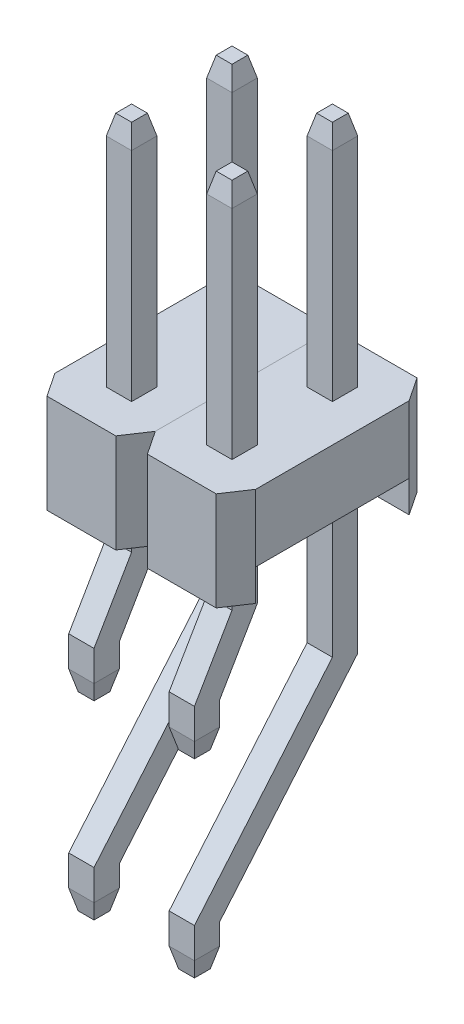
from build123d import *
from OCP.BRepFilletAPI import BRepFilletAPI_MakeChamfer

# Parameters (mm, degrees)
SKETCH_1_W             = 2.54
SKETCH_1_H             = 2.54
SKETCH_1_W_2           = 0.64
SKETCH_1_H_2           = 0.64
EXTRUDE_1_DEPTH        = 2.5
CHAMFER_1_SIZE         = 0.4
CHAMFER_1_SIZE2        = 0.6
CHAMFER_2_SIZE         = 0.6
CHAMFER_2_SIZE2        = 0.4
SKETCH_5_W             = 1.94
SKETCH_5_H             = 0.8
CUT_EXTRUDE_1_DEPTH    = 6
EXTRUDE_3_DEPTH        = 0.32
CHAMFER_3_SIZE         = 0.5
CHAMFER_3_SIZE2        = 0.12
CHAMFER_4_SIZE         = 0.5
CHAMFER_4_SIZE2        = 0.12
PATTERN_LINEAR_1_COUNT = 2
PATTERN_LINEAR_1_PITCH = 2.54


with BuildPart() as part:
    # 草图1 → 凸台-拉伸1 (new body)
    with BuildSketch(Plane(origin=(0, 0, 0), x_dir=(1, 0, 0), z_dir=(0, 1, 0))):
        with Locations((0, -1.27)):
            Rectangle(SKETCH_1_W, SKETCH_1_H)
        with Locations((0, -1.27)):
            Rectangle(SKETCH_1_W_2, SKETCH_1_H_2, mode=Mode.SUBTRACT)
    extrude(amount=EXTRUDE_1_DEPTH)

    # 倒角1
    chamfer_1_edges = [part.edges().sort_by_distance(p)[0] for p in [
        (1.27, 1.25, 2.54),
    ]]
    chamfer_1_side = [part.faces().sort_by_distance(p)[0] for p in [
        (0, 1.25, 2.54),
    ]]
    chamfer(chamfer_1_edges, length=CHAMFER_1_SIZE, length2=CHAMFER_1_SIZE2, reference=chamfer_1_side[0])

    # 倒角2
    chamfer_2_edges = [part.edges().sort_by_distance(p)[0] for p in [
        (-1.27, 1.25, 2.54),
    ]]
    chamfer_2_side = [part.faces().sort_by_distance(p)[0] for p in [
        (-1.27, 1.25, 1.27),
    ]]
    chamfer(chamfer_2_edges, length=CHAMFER_2_SIZE, length2=CHAMFER_2_SIZE2, reference=chamfer_2_side[0])

    # 草图5 → 切除-拉伸1 (cut)
    with BuildSketch(Plane(origin=(1.27, 0, 0), x_dir=(0, 0, -1), z_dir=(1, 0, 0))):
        with Locations((-0.97, 0.4)):
            Rectangle(SKETCH_5_W, SKETCH_5_H)
    extrude(amount=-CUT_EXTRUDE_1_DEPTH, mode=Mode.SUBTRACT)

    # 镜向1: part across plane


with BuildPart() as part_1:
    add(part.part)
    add(part.part.mirror(Plane(origin=(0, 2.5, 0), x_dir=(1, 0, 0), z_dir=(0, 0, -1))))

    # 草图6 → 凸台-拉伸3 (add, symmetric)
    with BuildSketch(Plane(origin=(0, 0, 0), x_dir=(0, 0, -1), z_dir=(1, 0, 0))):
        Polygon((-1.59, 8.5), (-0.95, 8.5), (-0.95, -0.972892443), (-1.9, -2.602892443), (-1.9, -3.7), (-2.54, -3.7), (-2.54, -2.43), (-1.59, -0.8), align=None)
        Polygon((0.95, 8.5), (1.59, 8.5), (1.59, -3.33420056), (-1.9, -7.46420056), (-1.9, -8.5), (-2.54, -8.5), (-2.54, -7.23), (0.95, -3.1), align=None)
    extrude(amount=EXTRUDE_3_DEPTH, both=True)

    # 倒角3: one chamfer whose edges measure the first distance from different faces: ONE call of the kernel's chamfer builder (chamfer() names one face for all edges)
    chamfer_3_edges_1 = [part_1.edges().sort_by_distance(p)[0] for p in [
        (-0.32, 8.5, 1.27),
    ]]
    chamfer_3_side_1 = [part_1.faces().sort_by_distance(p)[0] for p in [
        (-0.32, 5.5, 1.27),
    ]]
    chamfer_3_edges_2 = [part_1.edges().sort_by_distance(p)[0] for p in [
        (0, 8.5, 0.95),
    ]]
    chamfer_3_side_2 = [part_1.faces().sort_by_distance(p)[0] for p in [
        (0, 5.5, 0.95),
    ]]
    chamfer_3_edges_3 = [part_1.edges().sort_by_distance(p)[0] for p in [
        (0.32, 8.5, 1.27),
    ]]
    chamfer_3_side_3 = [part_1.faces().sort_by_distance(p)[0] for p in [
        (0.32, 5.5, 1.27),
    ]]
    chamfer_3_edges_4 = [part_1.edges().sort_by_distance(p)[0] for p in [
        (0, 8.5, -0.95),
    ]]
    chamfer_3_side_4 = [part_1.faces().sort_by_distance(p)[0] for p in [
        (0, 5.5, -0.95),
    ]]
    chamfer_3_edges_5 = [part_1.edges().sort_by_distance(p)[0] for p in [
        (-0.32, 8.5, -1.27),
    ]]
    chamfer_3_side_5 = [part_1.faces().sort_by_distance(p)[0] for p in [
        (-0.32, 5.5, -1.27),
    ]]
    chamfer_3_edges_6 = [part_1.edges().sort_by_distance(p)[0] for p in [
        (0, 8.5, -1.59),
    ]]
    chamfer_3_side_6 = [part_1.faces().sort_by_distance(p)[0] for p in [
        (0, 5.5, -1.59),
    ]]
    chamfer_3_edges_7 = [part_1.edges().sort_by_distance(p)[0] for p in [
        (0.32, 8.5, -1.27),
    ]]
    chamfer_3_side_7 = [part_1.faces().sort_by_distance(p)[0] for p in [
        (0.32, 5.5, -1.27),
    ]]
    chamfer_3_edges_8 = [part_1.edges().sort_by_distance(p)[0] for p in [
        (0, 8.5, 1.59),
    ]]
    chamfer_3_side_8 = [part_1.faces().sort_by_distance(p)[0] for p in [
        (0, 5.5, 1.59),
    ]]
    chamfer_3 = BRepFilletAPI_MakeChamfer(part_1.part.solid().wrapped)
    for e in chamfer_3_edges_1:
        chamfer_3.Add(CHAMFER_3_SIZE, CHAMFER_3_SIZE2, e.wrapped, chamfer_3_side_1[0].wrapped)  # the first distance lies on this face
    for e in chamfer_3_edges_2:
        chamfer_3.Add(CHAMFER_3_SIZE, CHAMFER_3_SIZE2, e.wrapped, chamfer_3_side_2[0].wrapped)  # the first distance lies on this face
    for e in chamfer_3_edges_3:
        chamfer_3.Add(CHAMFER_3_SIZE, CHAMFER_3_SIZE2, e.wrapped, chamfer_3_side_3[0].wrapped)  # the first distance lies on this face
    for e in chamfer_3_edges_4:
        chamfer_3.Add(CHAMFER_3_SIZE, CHAMFER_3_SIZE2, e.wrapped, chamfer_3_side_4[0].wrapped)  # the first distance lies on this face
    for e in chamfer_3_edges_5:
        chamfer_3.Add(CHAMFER_3_SIZE, CHAMFER_3_SIZE2, e.wrapped, chamfer_3_side_5[0].wrapped)  # the first distance lies on this face
    for e in chamfer_3_edges_6:
        chamfer_3.Add(CHAMFER_3_SIZE, CHAMFER_3_SIZE2, e.wrapped, chamfer_3_side_6[0].wrapped)  # the first distance lies on this face
    for e in chamfer_3_edges_7:
        chamfer_3.Add(CHAMFER_3_SIZE, CHAMFER_3_SIZE2, e.wrapped, chamfer_3_side_7[0].wrapped)  # the first distance lies on this face
    for e in chamfer_3_edges_8:
        chamfer_3.Add(CHAMFER_3_SIZE, CHAMFER_3_SIZE2, e.wrapped, chamfer_3_side_8[0].wrapped)  # the first distance lies on this face
    add(Compound.cast(chamfer_3.Shape()), mode=Mode.REPLACE)

    # 倒角4: one chamfer whose edges measure the first distance from different faces: ONE call of the kernel's chamfer builder (chamfer() names one face for all edges)
    chamfer_4_edges_1 = [part_1.edges().sort_by_distance(p)[0] for p in [
        (0, -3.7, 2.54),
    ]]
    chamfer_4_side_1 = [part_1.faces().sort_by_distance(p)[0] for p in [
        (0, -3.065, 2.54),
    ]]
    chamfer_4_edges_2 = [part_1.edges().sort_by_distance(p)[0] for p in [
        (0, -3.7, 1.9),
    ]]
    chamfer_4_side_2 = [part_1.faces().sort_by_distance(p)[0] for p in [
        (0, -3.151446221, 1.9),
    ]]
    chamfer_4_edges_3 = [part_1.edges().sort_by_distance(p)[0] for p in [
        (0.32, -8.5, 2.22),
    ]]
    chamfer_4_side_3 = [part_1.faces().sort_by_distance(p)[0] for p in [
        (0.32, -1.15, -1.051757997),
    ]]
    chamfer_4_edges_4 = [part_1.edges().sort_by_distance(p)[0] for p in [
        (-0.32, -8.5, 2.22),
    ]]
    chamfer_4_side_4 = [part_1.faces().sort_by_distance(p)[0] for p in [
        (-0.32, -1.15, -1.051757997),
    ]]
    chamfer_4_edges_5 = [part_1.edges().sort_by_distance(p)[0] for p in [
        (0, -8.5, 2.54),
    ]]
    chamfer_4_side_5 = [part_1.faces().sort_by_distance(p)[0] for p in [
        (0, -7.865, 2.54),
    ]]
    chamfer_4_edges_6 = [part_1.edges().sort_by_distance(p)[0] for p in [
        (0, -8.5, 1.9),
    ]]
    chamfer_4_side_6 = [part_1.faces().sort_by_distance(p)[0] for p in [
        (0, -7.98210028, 1.9),
    ]]
    chamfer_4_edges_7 = [part_1.edges().sort_by_distance(p)[0] for p in [
        (0.32, -3.7, 2.22),
    ]]
    chamfer_4_side_7 = [part_1.faces().sort_by_distance(p)[0] for p in [
        (0.32, -1.463566403, 1.694780927),
    ]]
    chamfer_4_edges_8 = [part_1.edges().sort_by_distance(p)[0] for p in [
        (-0.32, -3.7, 2.22),
    ]]
    chamfer_4_side_8 = [part_1.faces().sort_by_distance(p)[0] for p in [
        (-0.32, -1.463566403, 1.694780927),
    ]]
    chamfer_4 = BRepFilletAPI_MakeChamfer(part_1.part.solid().wrapped)
    for e in chamfer_4_edges_1:
        chamfer_4.Add(CHAMFER_4_SIZE, CHAMFER_4_SIZE2, e.wrapped, chamfer_4_side_1[0].wrapped)  # the first distance lies on this face
    for e in chamfer_4_edges_2:
        chamfer_4.Add(CHAMFER_4_SIZE, CHAMFER_4_SIZE2, e.wrapped, chamfer_4_side_2[0].wrapped)  # the first distance lies on this face
    for e in chamfer_4_edges_3:
        chamfer_4.Add(CHAMFER_4_SIZE, CHAMFER_4_SIZE2, e.wrapped, chamfer_4_side_3[0].wrapped)  # the first distance lies on this face
    for e in chamfer_4_edges_4:
        chamfer_4.Add(CHAMFER_4_SIZE, CHAMFER_4_SIZE2, e.wrapped, chamfer_4_side_4[0].wrapped)  # the first distance lies on this face
    for e in chamfer_4_edges_5:
        chamfer_4.Add(CHAMFER_4_SIZE, CHAMFER_4_SIZE2, e.wrapped, chamfer_4_side_5[0].wrapped)  # the first distance lies on this face
    for e in chamfer_4_edges_6:
        chamfer_4.Add(CHAMFER_4_SIZE, CHAMFER_4_SIZE2, e.wrapped, chamfer_4_side_6[0].wrapped)  # the first distance lies on this face
    for e in chamfer_4_edges_7:
        chamfer_4.Add(CHAMFER_4_SIZE, CHAMFER_4_SIZE2, e.wrapped, chamfer_4_side_7[0].wrapped)  # the first distance lies on this face
    for e in chamfer_4_edges_8:
        chamfer_4.Add(CHAMFER_4_SIZE, CHAMFER_4_SIZE2, e.wrapped, chamfer_4_side_8[0].wrapped)  # the first distance lies on this face
    add(Compound.cast(chamfer_4.Shape()), mode=Mode.REPLACE)


with BuildPart() as pattern_linear_1_1:
    # 阵列(线性)1: pattern copy
    add(part_1.part.moved(Location(Vector(-1, 0, 0) * (1 * PATTERN_LINEAR_1_PITCH))))


solid = Compound([part_1.part, pattern_linear_1_1.part])
